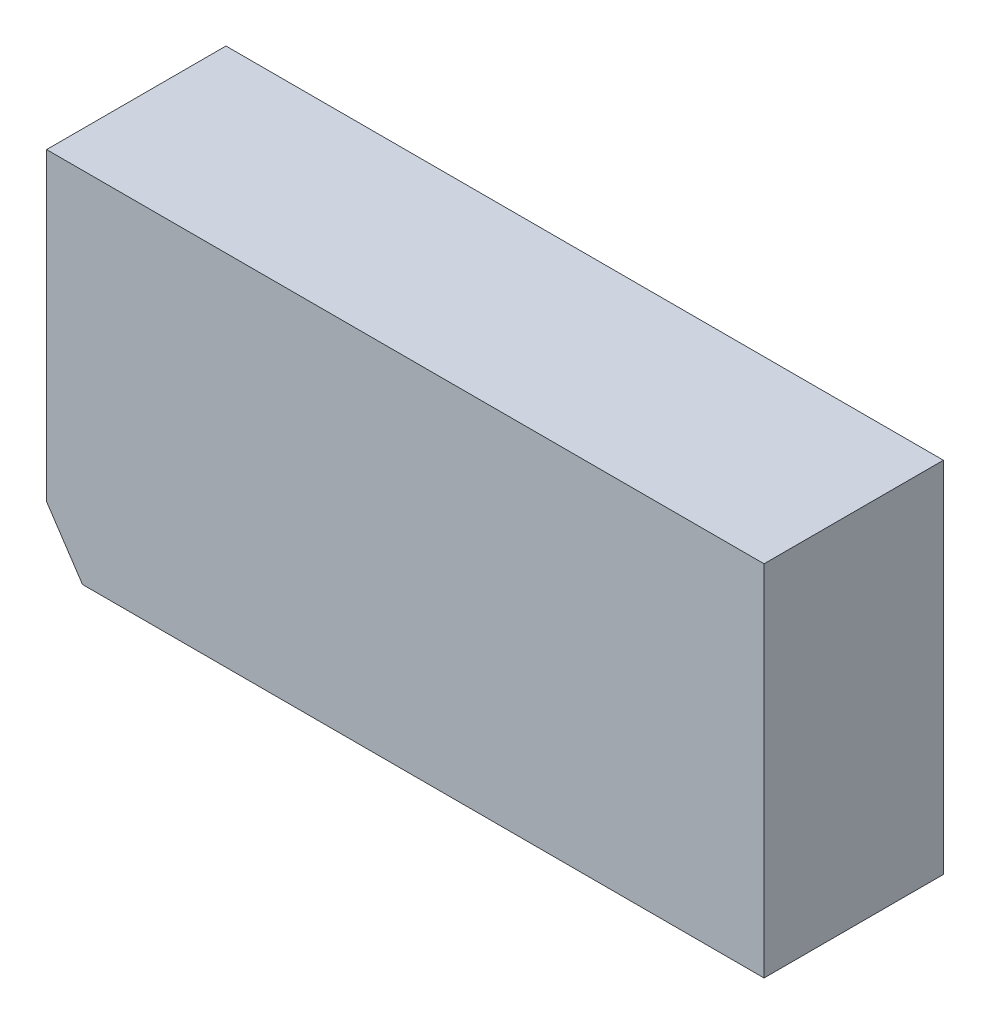
from build123d import *

# Parameters (mm, degrees)
SKETCH1_W           = 40
SKETCH1_H           = 20
BOSS_EXTRUDE1_DEPTH = 10
CHAMFER1_SIZE       = 3
CHAMFER1_SIZE2      = 2


with BuildPart() as part:
    # Sketch1 → Boss-Extrude1 (new body)
    with BuildSketch(Plane.XY):
        with Locations((20, 10)):
            Rectangle(SKETCH1_W, SKETCH1_H)
    extrude(amount=BOSS_EXTRUDE1_DEPTH)

    # Chamfer1
    chamfer1_edges = [part.edges().sort_by_distance(p)[0] for p in [
        (0, 0, 5),
    ]]
    chamfer1_side = [part.faces().sort_by_distance(p)[0] for p in [
        (0, 10, 5),
    ]]
    chamfer(chamfer1_edges, length=CHAMFER1_SIZE, length2=CHAMFER1_SIZE2, reference=chamfer1_side[0])


solid = part.part
